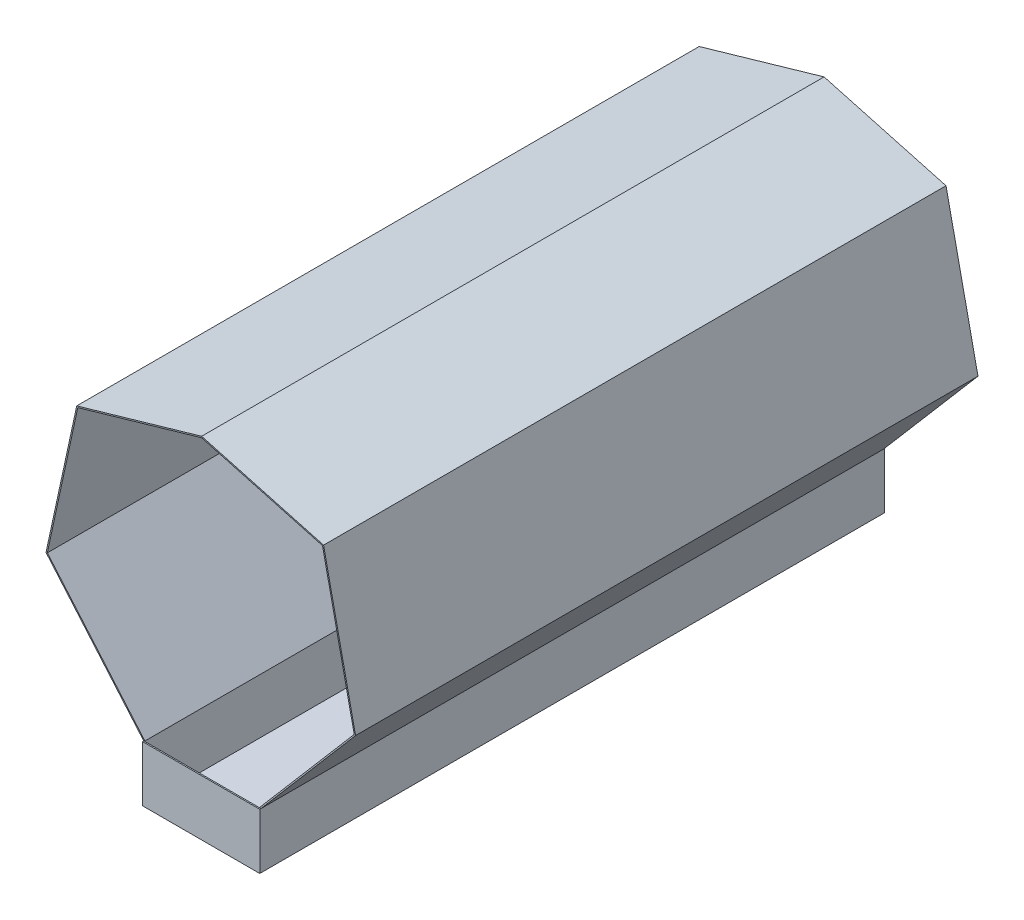
from build123d import *

# Parameters (mm, degrees)
EXTRUDE_THIN1_DEPTH = 5000
SKETCH3_W           = 942.686486423
SKETCH3_H           = 446.87009075
BOSS_EXTRUDE1_DEPTH = 10
SKETCH4_W           = 942.686486423
SKETCH4_H           = 446.875098961
BOSS_EXTRUDE2_DEPTH = 10
BOSS_EXTRUDE5_DEPTH = 500
BOSS_EXTRUDE5_DRAFT = -20


with BuildPart() as part:
    # Sketch2 → Extrude-Thin1 (new body)
    with BuildSketch(Plane.XY):
        Polygon((1921.887541059, 12.24380069), (1921.887541059, 459.11389144), (2681.447187748, 1346.59937336), (2424.606954424, 2543.190863223), (1445.029500253, 2810.547934615), (441.623250623, 2520.336455312), (194.832132021, 1377.229025334), (979.201054636, 459.118899651), (979.201054636, 12.24380069), align=None)
        Polygon((1911.887541059, 22.24380069), (1911.887541059, 462.808912872), (2670.631005203, 1349.340749924), (2416.106129236, 2535.14523468), (1445.107934874, 2800.160759962), (450.137888664, 2512.38925258), (205.652, 1379.959376498), (989.201054636, 462.808912872), (989.201054636, 22.24380069), align=None, mode=Mode.SUBTRACT)
    extrude(amount=EXTRUDE_THIN1_DEPTH)

    # Sketch3 → Boss-Extrude1 (add)
    with BuildSketch(Plane.XY.offset(5000)):
        with Locations((1450.544297848, 235.678846065)):
            Rectangle(SKETCH3_W, SKETCH3_H)
    extrude(amount=BOSS_EXTRUDE1_DEPTH)

    # Sketch4 → Boss-Extrude2 (add)
    with BuildSketch(Plane(origin=(0, 0, 0), x_dir=(-1, 0, 0), z_dir=(0, 0, -1))):
        with Locations((-1450.544297848, 235.681350171)):
            Rectangle(SKETCH4_W, SKETCH4_H)
    extrude(amount=BOSS_EXTRUDE2_DEPTH)


with BuildPart() as body_2:
    # Sketch5 → Boss-Extrude5 (with draft: the straight prism first)
    with BuildSketch(Plane.XY.offset(5000)):
        Polygon((989.201054636, 462.808912872), (1911.887541059, 462.808912872), (2670.631005203, 1349.340749924), (2416.106129236, 2535.14523468), (1445.107934874, 2800.160759962), (450.137888664, 2512.38925258), (205.652, 1379.959376498), align=None)
    extrude(amount=BOSS_EXTRUDE5_DEPTH)
    # Boss-Extrude5: the draft: its side faces are tilted about the plane it starts from
    boss_extrude5_sides = [body_2.faces().sort_by_distance(p)[0] for p in [
        (1450.544297848, 462.808912872, 5250),
        (2291.259273131, 906.074831398, 5250),
        (2543.368567219, 1942.242992302, 5250),
        (1930.607032055, 2667.652997321, 5250),
        (947.622911769, 2656.275006271, 5250),
        (327.894944332, 1946.174314539, 5250),
        (597.426527318, 921.384144685, 5250),
    ]]
    draft(boss_extrude5_sides, Plane.XY.offset(5000), BOSS_EXTRUDE5_DRAFT)

    # DeleteFace3: 1 face struck out; the rest of the skin is kept as a surface, the solid goes
    deleteface3_1_drop = [body_2.part.faces().sort_by_distance(Vector(p))[0] for p in ((1442.550000381, 1637.724947921, 5500),)]
    deleteface3_1 = Shell(body_2.part.faces() - deleteface3_1_drop)


solid = part.part
